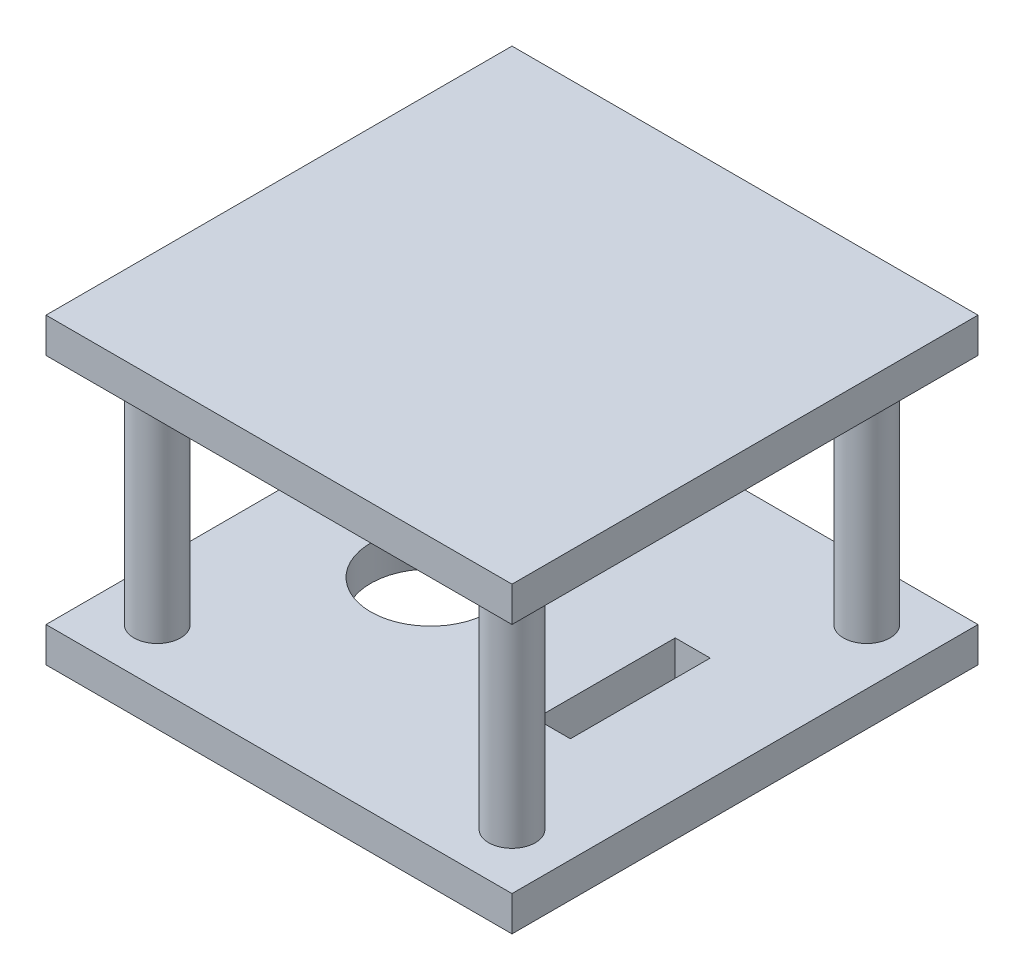
from build123d import *

# Parameters (mm, degrees)
SKETCH_2_W          = 40
SKETCH_2_H          = 40
EXTRUDE_2_DEPTH     = 3
SKETCH_3_R          = 2
SKETCH_3_R_2        = 5.125
SKETCH_3_W          = 3
SKETCH_3_H          = 12
CUT_EXTRUDE_1_DEPTH = 3
EXTRUDE_START       = 20
SKETCH_9_W          = 40
SKETCH_9_H          = 40
EXTRUDE_4_DEPTH     = 3
SKETCH_3_3_R        = 2
EXTRUDE_5_DEPTH     = 24
EXTRUDE_START_2     = -2
SKETCH_2_8_R        = 2
EXTRUDE_6_DEPTH     = 2


with BuildPart() as part:
    # 草图2 → 凸台-拉伸2 (new body)
    with BuildSketch(Plane(origin=(0, 0, 0), x_dir=(1, 0, 0), z_dir=(0, 1, 0))):
        Rectangle(SKETCH_2_W, SKETCH_2_H)
    extrude(amount=EXTRUDE_2_DEPTH)

    # 草图3 → 切除-拉伸1 (cut)
    with BuildSketch(Plane(origin=(0, 0, 0), x_dir=(1, 0, 0), z_dir=(0, 1, 0))):
        with Locations((-15.224798987, -15.224798987)):
            Circle(SKETCH_3_R)
        with Locations((15.224798987, -15.224798987)):
            Circle(SKETCH_3_R)
        with Locations((15.224798987, 15.224798987)):
            Circle(SKETCH_3_R)
        with Locations((-15.224798987, 15.224798987)):
            Circle(SKETCH_3_R)
        with Locations((-7, 0)):
            Circle(SKETCH_3_R_2)
        with Locations((9.5, 0.011605537)):
            Rectangle(SKETCH_3_W, SKETCH_3_H)
    extrude(amount=CUT_EXTRUDE_1_DEPTH, mode=Mode.SUBTRACT)



with BuildPart() as body_2:
    # 草图9 → 凸台-拉伸4 (new body)
    with BuildSketch(Plane(origin=(0, 3, 0), x_dir=(1, 0, 0), z_dir=(0, 1, 0)).offset(EXTRUDE_START)):
        Rectangle(SKETCH_9_W, SKETCH_9_H)
    extrude(amount=EXTRUDE_4_DEPTH)

    # 草图3<3> → 凸台-拉伸5 (add)
    with BuildSketch(Plane(origin=(0, 0, 0), x_dir=(1, 0, 0), z_dir=(0, 1, 0))):
        with Locations((-15.224798987, -15.224798987)):
            Circle(SKETCH_3_3_R)
        with Locations((15.224798987, -15.224798987)):
            Circle(SKETCH_3_3_R)
        with Locations((15.224798987, 15.224798987)):
            Circle(SKETCH_3_3_R)
        with Locations((-15.224798987, 15.224798987)):
            Circle(SKETCH_3_3_R)
    extrude(amount=EXTRUDE_5_DEPTH)


with BuildPart() as part_1:
    add(part.part)

    add(body_2.part)  # 凸台-拉伸6 merges body 2
    # 草图2<8> → 凸台-拉伸6 (add)
    with BuildSketch(Plane(origin=(0, 0, 0), x_dir=(1, 0, 0), z_dir=(0, 1, 0)).offset(EXTRUDE_START_2)):
        with Locations((15.224798987, 15.224798987)):
            Circle(SKETCH_2_8_R)
        with Locations((-15.224798987, -15.224798987)):
            Circle(SKETCH_2_8_R)
        with Locations((15.224798987, -15.224798987)):
            Circle(SKETCH_2_8_R)
        with Locations((-15.224798987, 15.224798987)):
            Circle(SKETCH_2_8_R)
    extrude(amount=EXTRUDE_6_DEPTH)


solid = part_1.part
